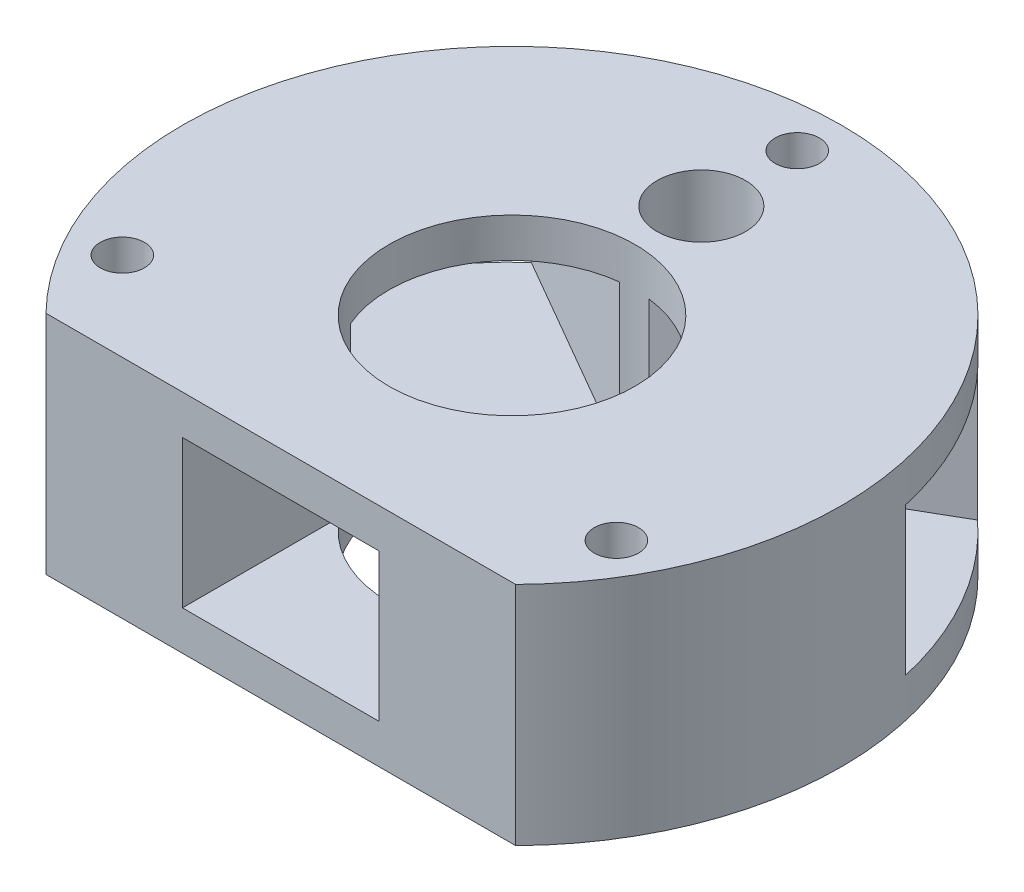
from build123d import *

# Parameters (mm, degrees)
SKETCH_1_R               = 33.5
EXTRUDE_1_DEPTH          = 23
HOLE_WIZARD_1_D          = 4.5
HOLE_WIZARD_2_D          = 9
HOLE_WIZARD_3_D          = 25
SKETCH_9_W               = 10
SKETCH_9_H               = 15
CUT_EXTRUDE_1_DEPTH      = 30
PATTERN_CIRCULAR_1_COUNT = 3
SKETCH_10_W              = 67
SKETCH_10_H              = 23
CUT_EXTRUDE_2_DEPTH      = 10


with BuildPart() as part:
    # 草图1 → 凸台-拉伸1 (new body)
    with BuildSketch(Plane(origin=(0, 0, 0), x_dir=(1, 0, 0), z_dir=(0, 1, 0))):
        with Locations(Location((0, 0, 0), (0, 0, 270))):
            Circle(SKETCH_1_R)
    extrude(amount=EXTRUDE_1_DEPTH)

    # 孔1 (through all)
    with Locations(Plane(origin=(0, 23, 0), x_dir=(1, 0, 0), z_dir=(0, 1, 0))):
        with Locations((0, 29), (-25.11473671, -14.5), (25.11473671, -14.5)):
            Hole(HOLE_WIZARD_1_D / 2)

    # 孔2 (through all)
    with Locations(Plane(origin=(0, 23, 0), x_dir=(1, 0, 0), z_dir=(0, 1, 0))):
        with Locations((0, 19.25)):
            Hole(HOLE_WIZARD_2_D / 2)

    # 孔3 (through all)
    with Locations(Plane(origin=(0, 23, 0), x_dir=(1, 0, 0), z_dir=(0, 1, 0))):
        with Locations((0, 0)):
            Hole(HOLE_WIZARD_3_D / 2)

    # 草图9 → 切除-拉伸1 (cut)
    with BuildSketch(Plane.XY.offset(33.5)):
        with Locations((5, 11.5)):
            Rectangle(SKETCH_9_W, SKETCH_9_H)
        with Locations((-5, 11.5)):
            Rectangle(SKETCH_9_W, SKETCH_9_H)
    cut_extrude_1 = extrude(amount=-CUT_EXTRUDE_1_DEPTH, mode=Mode.SUBTRACT)

    # 阵列(圆周)1: 切除-拉伸1 ×3 about axis
    pattern_circular_1_axis = Axis((0, 0, 0), (0, 1, 0))
    for i in range(1, PATTERN_CIRCULAR_1_COUNT):
        add(cut_extrude_1.rotate(pattern_circular_1_axis, i * 360 / PATTERN_CIRCULAR_1_COUNT), mode=Mode.SUBTRACT)

    # 草图10 → 切除-拉伸2 (cut)
    with BuildSketch(Plane.XY.offset(33.5)):
        with Locations((0, 11.5)):
            Rectangle(SKETCH_10_W, SKETCH_10_H)
    extrude(amount=-CUT_EXTRUDE_2_DEPTH, mode=Mode.SUBTRACT)


solid = part.part
